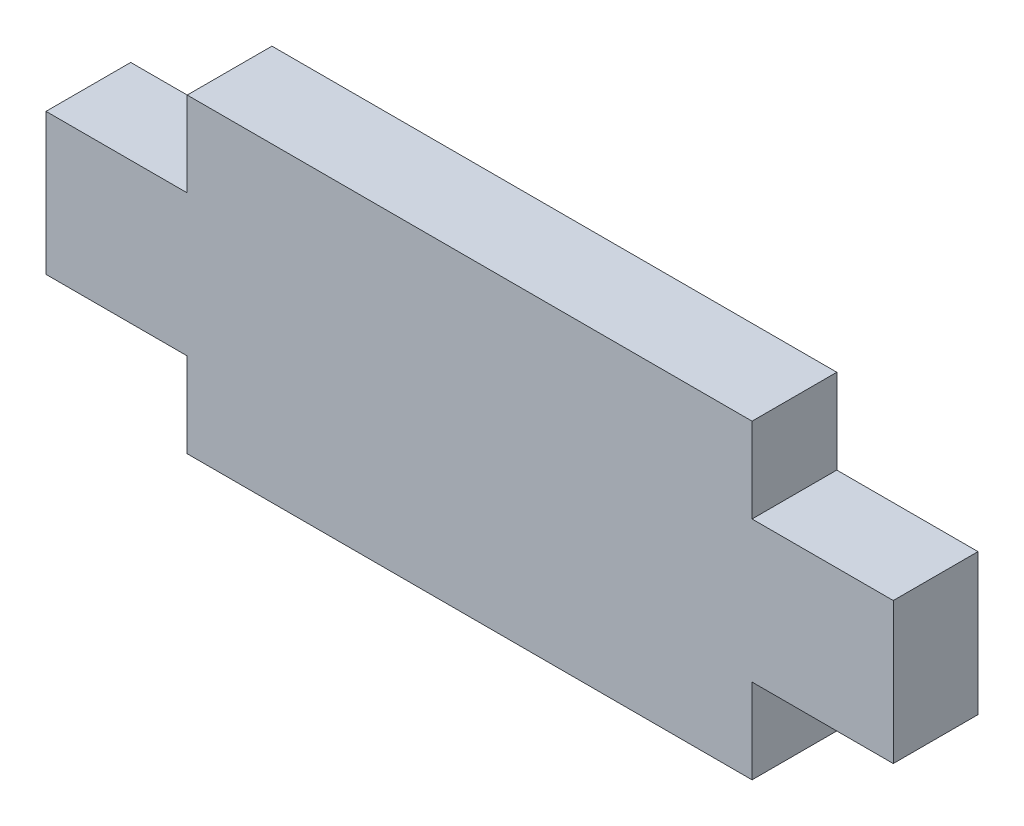
from build123d import *

# Parameters (mm, degrees)
SKETCH_1_W      = 20
SKETCH_1_H      = 3
SKETCH_1_W_2    = 30
SKETCH_1_H_2    = 5
EXTRUDE_1_DEPTH = 3


with BuildPart() as part:
    # 草图1 → 凸台-拉伸1 (new body)
    with BuildSketch(Plane.XY):
        with Locations((0, 4)):
            Rectangle(SKETCH_1_W, SKETCH_1_H)
        Rectangle(SKETCH_1_W_2, SKETCH_1_H_2)
        with Locations((0, -4)):
            Rectangle(SKETCH_1_W, SKETCH_1_H)
    extrude(amount=EXTRUDE_1_DEPTH)


solid = part.part
